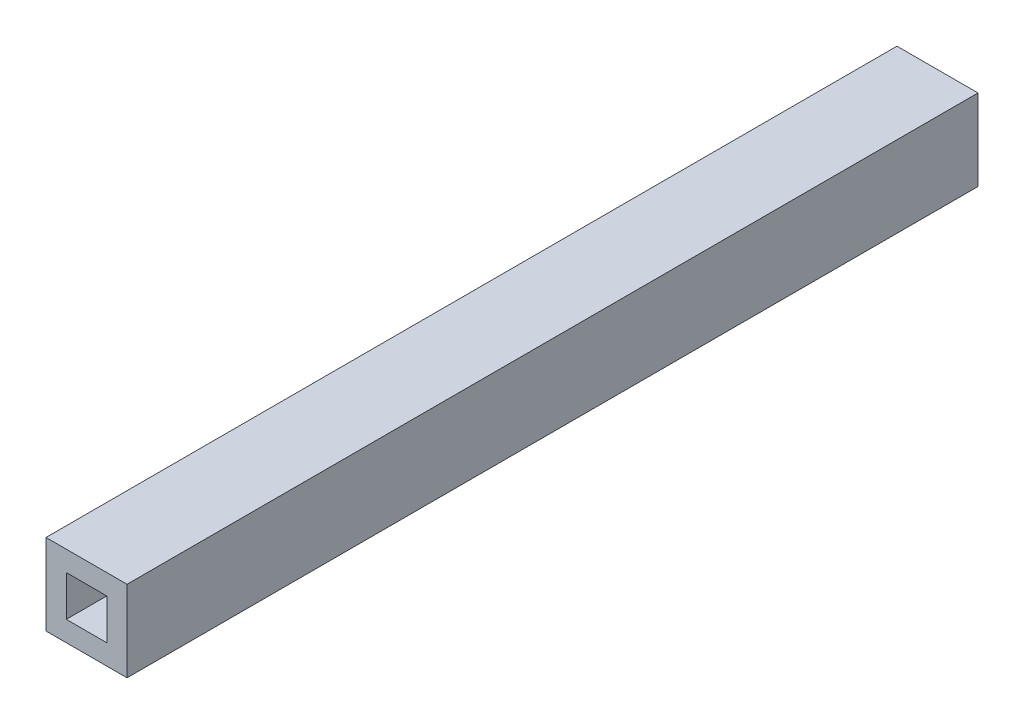
from build123d import *

# Parameters (mm, degrees)
SKETCH1_W           = 20
SKETCH1_H           = 20
SKETCH1_W_2         = 10
SKETCH1_H_2         = 10
EXTRUDE_THIN1_DEPTH = 210


with BuildPart() as part:
    # Sketch1 → Extrude-Thin1 (new body)
    with BuildSketch(Plane.XY):
        Rectangle(SKETCH1_W, SKETCH1_H)
        Rectangle(SKETCH1_W_2, SKETCH1_H_2, mode=Mode.SUBTRACT)
    extrude(amount=EXTRUDE_THIN1_DEPTH)


solid = part.part
